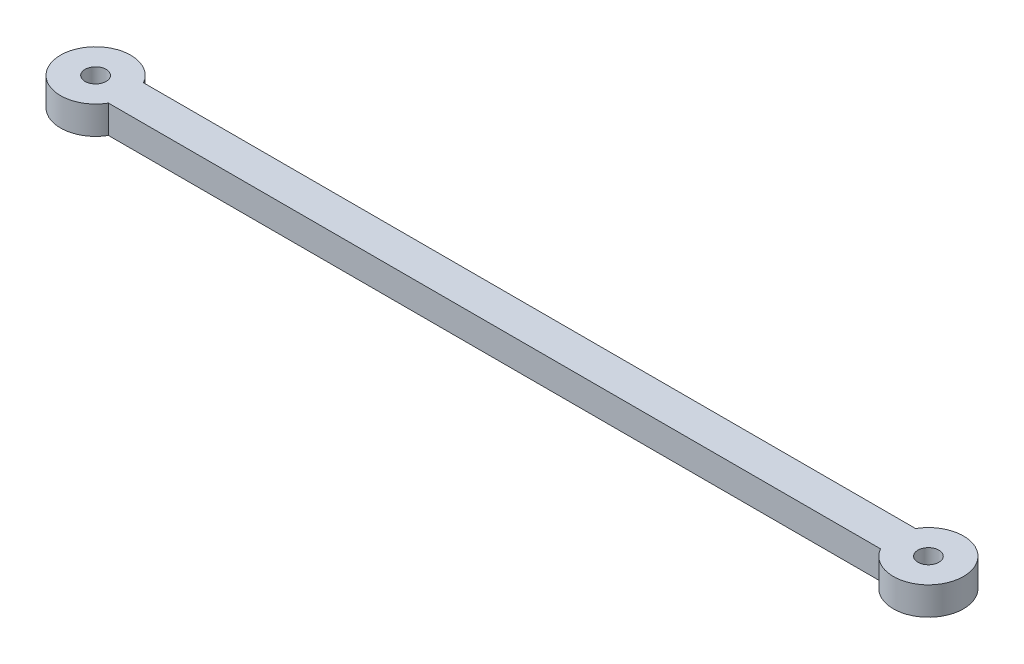
from build123d import *

# Parameters (mm, degrees)
BOSS_EXTRUDE1_DEPTH = 4
SKETCH2_R           = 1.5
CUT_EXTRUDE1_DEPTH  = 65.64801035


with BuildPart() as part:
    # Sketch1 → Boss-Extrude1 (new body)
    with BuildSketch(Plane(origin=(0, 0, 0), x_dir=(1, 0, 0), z_dir=(0, 1, 0))):
        with BuildLine():
            Line((-55, 2.5), (55, 2.5))
            ThreePointArc((55, 2.5), (64.330127019, 0), (55, -2.5))
            Line((55, -2.5), (-55, -2.5))
            ThreePointArc((-55, -2.5), (-64.330127019, 0), (-55, 2.5))
        make_face()
    extrude(amount=BOSS_EXTRUDE1_DEPTH)

    # Sketch2 → Cut-Extrude1 (cut, through all)
    with BuildSketch(Plane(origin=(0, 4, 0), x_dir=(1, 0, 0), z_dir=(0, 1, 0))):
        with Locations(Location((-59.330127019, 0, 0), (0, 0, 270))):
            Circle(SKETCH2_R)
        with Locations(Location((59.330127019, 0, 0), (0, 0, 270))):
            Circle(SKETCH2_R)
    extrude(amount=-CUT_EXTRUDE1_DEPTH, mode=Mode.SUBTRACT)


solid = part.part
